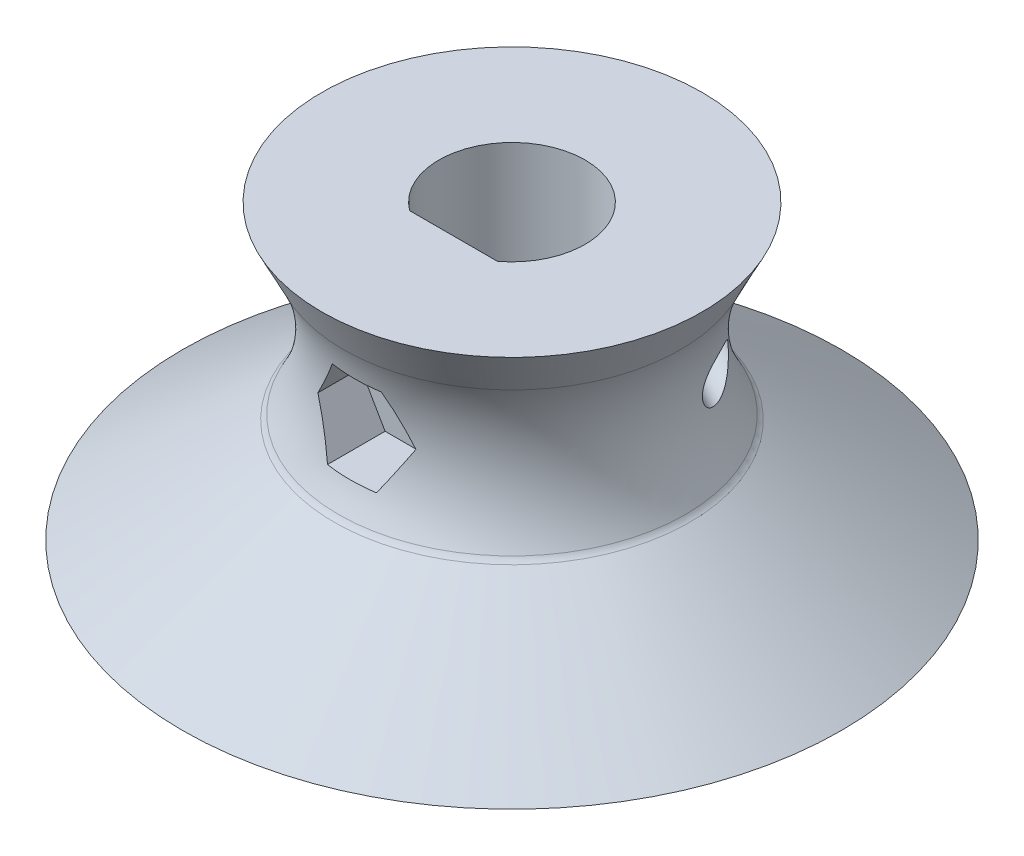
from build123d import *

# Parameters (mm, degrees)
SKETCH_1_R               = 8
EXTRUDE_1_DEPTH          = 16
FILLET_1_R               = 10
CUT_EXTRUDE_1_DEPTH      = 26.455844296
CUT_EXTRUDE_1_DEPTH_BACK = 26.455844296
SKETCH_3_R               = 1.65
CUT_EXTRUDE_2_DEPTH      = 8
SKETCH_6_R               = 3.25
CUT_EXTRUDE_3_DEPTH      = 7.5
FILLET_2_R               = 1


with BuildPart() as part:
    # 草图1 → 凸台-拉伸1 (new body)
    with BuildSketch(Plane(origin=(0, 0, 0), x_dir=(1, 0, 0), z_dir=(0, 1, 0))):
        with Locations(Location((0, 0, 0), (0, 0, 270))):
            Circle(SKETCH_1_R)
        with BuildLine():
            Line((3, -4), (-3, -4))
            ThreePointArc((-3, -4), (0, 5), (3, -4))
        make_face(mode=Mode.SUBTRACT)
    extrude(amount=EXTRUDE_1_DEPTH)

    # 草图2 → 旋转1 (revolve)
    with BuildSketch(Plane.XY, mode=Mode.PRIVATE) as revolve_1_sk:
        Polygon((8, 16), (13, 16), (9, 8), (14, 0), (8, 0), align=None)
    revolve(revolve_1_sk.sketch.rotate(Axis((0, 19.267994754, 0), (0, -1, 0)), 90), axis=Axis((0, 19.267994754, 0), (0, -1, 0)))

    # 圆角1
    fillet_1_edges = [part.edges().sort_by_distance(p)[0] for p in [
        (0, 8, -9),
    ]]
    fillet(fillet_1_edges, radius=FILLET_1_R)

    # 草图3 → 切除-拉伸1 (cut, two sides: drawn at the far end of the back side and taken through both)
    with BuildSketch(Plane.XY.offset(-CUT_EXTRUDE_1_DEPTH_BACK)):
        with Locations(Location((0, 8, 0), (0, 0, 270.000000028))):
            Circle(SKETCH_3_R)
    extrude(amount=CUT_EXTRUDE_1_DEPTH + CUT_EXTRUDE_1_DEPTH_BACK, mode=Mode.SUBTRACT)

    # 草图4 → 切除-拉伸2 (cut)
    with BuildSketch(Plane.XY.offset(15)):
        Polygon((3.348631561, 8), (1.674315781, 10.9), (-1.674315781, 10.9), (-3.348631561, 8), (-1.674315781, 5.1), (1.674315781, 5.1), align=None)
    extrude(amount=-CUT_EXTRUDE_2_DEPTH, mode=Mode.SUBTRACT)

    # 草图6 → 切除-拉伸3 (cut)
    with BuildSketch(Plane.XY.offset(-15)):
        with Locations(Location((0, 8, 0), (0, 0, 180))):
            Circle(SKETCH_6_R)
    extrude(amount=CUT_EXTRUDE_3_DEPTH, mode=Mode.SUBTRACT)

    # 草图7 → 旋转2 (revolve)
    with BuildSketch(Plane.XY, mode=Mode.PRIVATE) as revolve_2_sk:
        Polygon((11.972417526, 3.244131958), (22.536438981, -4), (19, -4), (13.166853107, 0), align=None)
    revolve(revolve_2_sk.sketch.rotate(Axis((0, 21.03700922, 0), (0, -1, 0)), 90), axis=Axis((0, 21.03700922, 0), (0, -1, 0)))

    # 圆角2
    fillet_2_edges = [part.edges().sort_by_distance(p)[0] for p in [
        (0, 3.244131958, -11.97241447),
    ]]
    fillet(fillet_2_edges, radius=FILLET_2_R)

    # 草图10 → 切除-旋转1 (revolve, cut)
    with BuildSketch(Plane(origin=(0, 8, 0), x_dir=(1, 0, 0), z_dir=(0, 1, 0)), mode=Mode.PRIVATE) as cut_revolve_1_sk:
        Polygon((1.254039401, 8.908286257), (1.826463655, 10.019515519), (14.936167514, 3.266352423), (14.36374326, 2.155123161), align=None)
    revolve(cut_revolve_1_sk.sketch.rotate(Axis((14.36374326, 8, -2.155123161), (0.8889834100103146, 0, 0.45793940289784313)), 180), axis=Axis((14.36374326, 8, -2.155123161), (0.8889834100103146, 0, 0.45793940289784313)), mode=Mode.SUBTRACT)


solid = part.part
